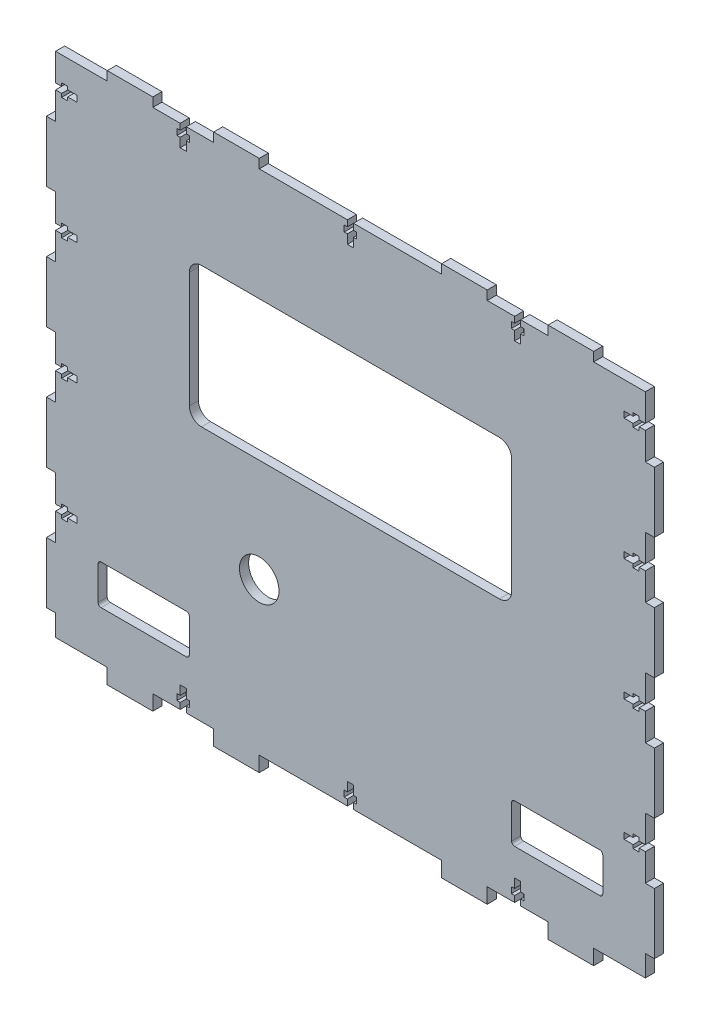
from build123d import *

# Parameters (mm, degrees)
SKETCH_1_W             = 200
SKETCH_1_H             = 175
EXTRUDE_1_DEPTH        = 3
SKETCH_2_W             = 20
SKETCH_2_H             = 3
SKETCH_2_W_2           = 60
CUT_EXTRUDE_1_DEPTH    = 266.770577755
SKETCH_3_W             = 3
SKETCH_3_H             = 20
CUT_EXTRUDE_2_DEPTH    = 266.770577755
PATTERN_LINEAR_1_COUNT = 5
PATTERN_LINEAR_1_PITCH = 40
SKETCH_4_W             = 17
SKETCH_4_H             = 2
SKETCH_4_W_2           = 20
SKETCH_4_W_3           = 60
CUT_EXTRUDE_3_DEPTH    = 266.770577755
SKETCH_5_W             = 106
SKETCH_5_H             = 46
CUT_EXTRUDE_4_DEPTH    = 266.770577755
FILLET_1_R             = 4
SKETCH_6_W             = 30
SKETCH_6_H             = 13
CUT_EXTRUDE_5_DEPTH    = 266.770577755
FILLET_2_R             = 1
CUT_EXTRUDE_6_DEPTH    = 266.770577755
PATTERN_LINEAR_2_COUNT = 4
PATTERN_LINEAR_2_PITCH = 40
MIRROR_2_COPY_1_DEPTH  = 266.770577755
MIRROR_2_COPY_2_DEPTH  = 266.770577755
MIRROR_2_COPY_3_DEPTH  = 266.770577755
CUT_EXTRUDE_7_DEPTH    = 266.770577755
PATTERN_LINEAR_3_COUNT = 3
PATTERN_LINEAR_3_PITCH = 55
MIRROR_3_COPY_1_DEPTH  = 266.770577755
MIRROR_3_COPY_2_DEPTH  = 266.770577755
SKETCH_9_R             = 6.5
CUT_EXTRUDE_8_DEPTH    = 266.770577755


with BuildPart() as part:
    # 草图1 → 凸台-拉伸1 (new body)
    with BuildSketch(Plane.XY):
        with Locations((100, 87.5)):
            Rectangle(SKETCH_1_W, SKETCH_1_H)
    extrude(amount=EXTRUDE_1_DEPTH)

    # 草图2 → 切除-拉伸1 (cut, through all)
    with BuildSketch(Plane.XY.offset(3)):
        with Locations((10, 173.5)):
            Rectangle(SKETCH_2_W, SKETCH_2_H)
        with Locations((190, 173.5)):
            Rectangle(SKETCH_2_W, SKETCH_2_H)
        with Locations((45, 173.5)):
            Rectangle(SKETCH_2_W, SKETCH_2_H)
        with Locations((155, 173.5)):
            Rectangle(SKETCH_2_W, SKETCH_2_H)
        with Locations((100, 173.5)):
            Rectangle(SKETCH_2_W_2, SKETCH_2_H)
    cut_extrude_1 = extrude(amount=-CUT_EXTRUDE_1_DEPTH, mode=Mode.SUBTRACT)

    # 镜向1: 切除-拉伸1 across plane
    add(cut_extrude_1.mirror(Plane(origin=(0, 87.5, 0), x_dir=(0, 0, 1), z_dir=(0, -1, 0))), mode=Mode.SUBTRACT)

    # 草图3 → 切除-拉伸2 (cut, through all)
    with BuildSketch(Plane.XY.offset(3)):
        with Locations((1.5, 162)):
            Rectangle(SKETCH_3_W, SKETCH_3_H)
        with Locations((198.5, 162)):
            Rectangle(SKETCH_3_W, SKETCH_3_H)
    cut_extrude_2 = extrude(amount=-CUT_EXTRUDE_2_DEPTH, mode=Mode.SUBTRACT)

    # 阵列(线性)1: 切除-拉伸2 ×5
    with Locations(*[(0, -i * PATTERN_LINEAR_1_PITCH, 0) for i in range(1, PATTERN_LINEAR_1_COUNT)]):
        add(cut_extrude_2, mode=Mode.SUBTRACT)

    # 草图4 → 切除-拉伸3 (cut, through all)
    with BuildSketch(Plane.XY.offset(3)):
        with Locations((11.5, 4)):
            Rectangle(SKETCH_4_W, SKETCH_4_H)
        with Locations((45, 4)):
            Rectangle(SKETCH_4_W_2, SKETCH_4_H)
        with Locations((100, 4)):
            Rectangle(SKETCH_4_W_3, SKETCH_4_H)
        with Locations((155, 4)):
            Rectangle(SKETCH_4_W_2, SKETCH_4_H)
        with Locations((188.5, 4)):
            Rectangle(SKETCH_4_W, SKETCH_4_H)
    extrude(amount=-CUT_EXTRUDE_3_DEPTH, mode=Mode.SUBTRACT)

    # 草图5 → 切除-拉伸4 (cut, through all)
    with BuildSketch(Plane.XY.offset(3)):
        with Locations((100, 112)):
            Rectangle(SKETCH_5_W, SKETCH_5_H)
    extrude(amount=-CUT_EXTRUDE_4_DEPTH, mode=Mode.SUBTRACT)

    # 圆角1
    fillet_1_edges = [part.edges().sort_by_distance(p)[0] for p in [
        (47, 89, 1.5),
        (47, 135, 1.5),
        (153, 135, 1.5),
        (153, 89, 1.5),
    ]]
    fillet(fillet_1_edges, radius=FILLET_1_R)

    # 草图6 → 切除-拉伸5 (cut, through all)
    with BuildSketch(Plane.XY.offset(3)):
        with Locations((32, 27.5)):
            Rectangle(SKETCH_6_W, SKETCH_6_H)
        with Locations((168, 27.5)):
            Rectangle(SKETCH_6_W, SKETCH_6_H)
    extrude(amount=-CUT_EXTRUDE_5_DEPTH, mode=Mode.SUBTRACT)

    # 圆角2
    fillet_2_edges = [part.edges().sort_by_distance(p)[0] for p in [
        (17, 21, 1.5),
        (17, 34, 1.5),
        (47, 34, 1.5),
        (47, 21, 1.5),
        (153, 21, 1.5),
        (153, 34, 1.5),
        (183, 34, 1.5),
        (183, 21, 1.5),
    ]]
    fillet(fillet_2_edges, radius=FILLET_2_R)

    # 草图7 → 切除-拉伸6 (cut, through all)
    with BuildSketch(Plane.XY.offset(3)):
        Polygon((5, 164.05), (7, 164.05), (7, 163), (10, 163), (10, 161), (7, 161), (7, 159.85), (5, 159.85), (5, 161), (3, 161), (3, 163), (5, 163), align=None)
    cut_extrude_6 = extrude(amount=-CUT_EXTRUDE_6_DEPTH, mode=Mode.SUBTRACT)

    # 阵列(线性)2: 切除-拉伸6 ×4
    with Locations(*[(0, -i * PATTERN_LINEAR_2_PITCH, 0) for i in range(1, PATTERN_LINEAR_2_COUNT)]):
        add(cut_extrude_6, mode=Mode.SUBTRACT)

    # 镜向2: 切除-拉伸6 across plane
    add(cut_extrude_6.mirror(Plane.ZY.offset(-100)), mode=Mode.SUBTRACT)

    # 镜向2 copy 1 sketch → 镜向2 copy 1 (cut, through all)
    with BuildSketch(Plane(origin=(200, -40, 3), x_dir=(-1, 0, 0), z_dir=(0, 0, 1))):
        Polygon((5, -164.05), (7, -164.05), (7, -163), (10, -163), (10, -161), (7, -161), (7, -159.85), (5, -159.85), (5, -161), (3, -161), (3, -163), (5, -163), align=None)
    extrude(amount=-MIRROR_2_COPY_1_DEPTH, mode=Mode.SUBTRACT)

    # 镜向2 copy 2 sketch → 镜向2 copy 2 (cut, through all)
    with BuildSketch(Plane(origin=(200, -80, 3), x_dir=(-1, 0, 0), z_dir=(0, 0, 1))):
        Polygon((5, -164.05), (7, -164.05), (7, -163), (10, -163), (10, -161), (7, -161), (7, -159.85), (5, -159.85), (5, -161), (3, -161), (3, -163), (5, -163), align=None)
    extrude(amount=-MIRROR_2_COPY_2_DEPTH, mode=Mode.SUBTRACT)

    # 镜向2 copy 3 sketch → 镜向2 copy 3 (cut, through all)
    with BuildSketch(Plane(origin=(200, -120, 3), x_dir=(-1, 0, 0), z_dir=(0, 0, 1))):
        Polygon((5, -164.05), (7, -164.05), (7, -163), (10, -163), (10, -161), (7, -161), (7, -159.85), (5, -159.85), (5, -161), (3, -161), (3, -163), (5, -163), align=None)
    extrude(amount=-MIRROR_2_COPY_3_DEPTH, mode=Mode.SUBTRACT)

    # 草图8 → 切除-拉伸7 (cut, through all)
    with BuildSketch(Plane.XY.offset(3)):
        Polygon((44, 172), (46, 172), (46, 170), (47.05, 170), (47.05, 168), (46, 168), (46, 165), (44, 165), (44, 168), (42.95, 168), (42.95, 170), (44, 170), align=None)
    cut_extrude_7 = extrude(amount=-CUT_EXTRUDE_7_DEPTH, mode=Mode.SUBTRACT)

    # 阵列(线性)3: 切除-拉伸7 ×3
    with Locations(*[(i * PATTERN_LINEAR_3_PITCH, 0, 0) for i in range(1, PATTERN_LINEAR_3_COUNT)]):
        add(cut_extrude_7, mode=Mode.SUBTRACT)

    # 镜向3: 切除-拉伸7 across plane
    add(cut_extrude_7.mirror(Plane.ZX.offset(88.5)), mode=Mode.SUBTRACT)

    # 镜向3 copy 1 sketch → 镜向3 copy 1 (cut, through all)
    with BuildSketch(Plane(origin=(55, 177, 3), x_dir=(1, 0, 0), z_dir=(0, 0, 1))):
        Polygon((44, -172), (46, -172), (46, -170), (47.05, -170), (47.05, -168), (46, -168), (46, -165), (44, -165), (44, -168), (42.95, -168), (42.95, -170), (44, -170), align=None)
    extrude(amount=-MIRROR_3_COPY_1_DEPTH, mode=Mode.SUBTRACT)

    # 镜向3 copy 2 sketch → 镜向3 copy 2 (cut, through all)
    with BuildSketch(Plane(origin=(110, 177, 3), x_dir=(1, 0, 0), z_dir=(0, 0, 1))):
        Polygon((44, -172), (46, -172), (46, -170), (47.05, -170), (47.05, -168), (46, -168), (46, -165), (44, -165), (44, -168), (42.95, -168), (42.95, -170), (44, -170), align=None)
    extrude(amount=-MIRROR_3_COPY_2_DEPTH, mode=Mode.SUBTRACT)

    # 草图9 → 切除-拉伸8 (cut, through all)
    with BuildSketch(Plane.XY.offset(3)):
        with Locations((70, 55)):
            Circle(SKETCH_9_R)
    extrude(amount=-CUT_EXTRUDE_8_DEPTH, mode=Mode.SUBTRACT)


solid = part.part
